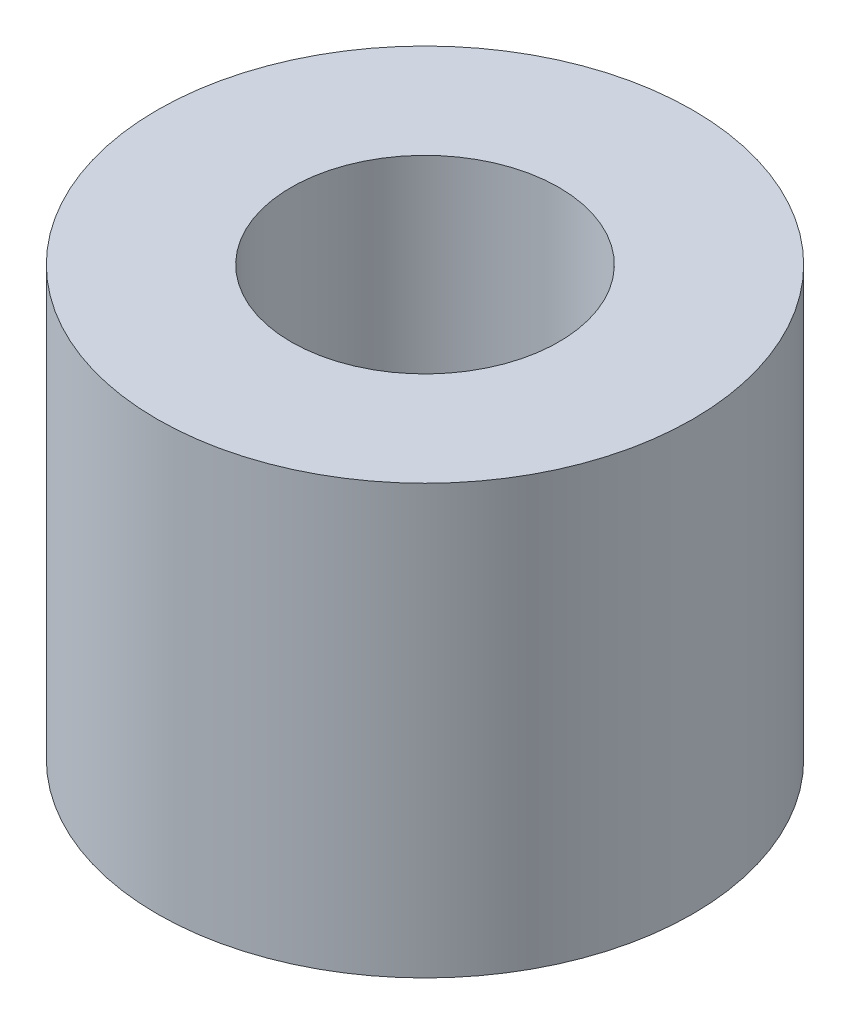
from build123d import *

# Parameters (mm, degrees)
SKETCH1_R             = 2.5
BOSS_EXTRUDE1_DEPTH   = 4
M3X0_5_TAPPED_HOLE1_D = 2.5


with BuildPart() as part:
    # Sketch1 → Boss-Extrude1 (new body)
    with BuildSketch(Plane(origin=(0, 0, 0), x_dir=(1, 0, 0), z_dir=(0, 1, 0))):
        with Locations(Location((0, 0, 0), (0, 0, 270))):
            Circle(SKETCH1_R)
    extrude(amount=BOSS_EXTRUDE1_DEPTH)

    # M3x0.5 Tapped Hole1 (through all)
    with Locations(Plane(origin=(0, 4, 0), x_dir=(1, 0, 0), z_dir=(0, 1, 0))):
        with Locations((0, 0)):
            Hole(M3X0_5_TAPPED_HOLE1_D / 2)


solid = part.part
